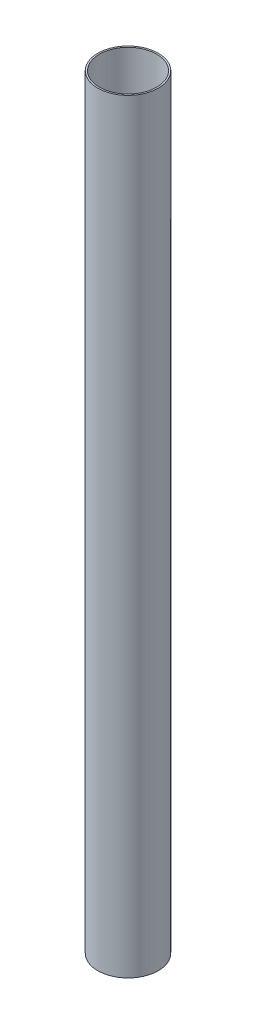
from build123d import *

# Parameters (mm, degrees)
SKETCH1_R           = 48.26
SKETCH1_R_2         = 45.72
BOSS_EXTRUDE1_DEPTH = 1219.2


with BuildPart() as part:
    # Sketch1 → Boss-Extrude1 (new body)
    with BuildSketch(Plane(origin=(0, 0, 0), x_dir=(1, 0, 0), z_dir=(0, 1, 0))):
        with Locations(Location((0, 0, 0), (0, 0, 90))):
            Circle(SKETCH1_R)
        with Locations(Location((0, 0, 0), (0, 0, 90))):
            Circle(SKETCH1_R_2, mode=Mode.SUBTRACT)
    extrude(amount=BOSS_EXTRUDE1_DEPTH)


solid = part.part
